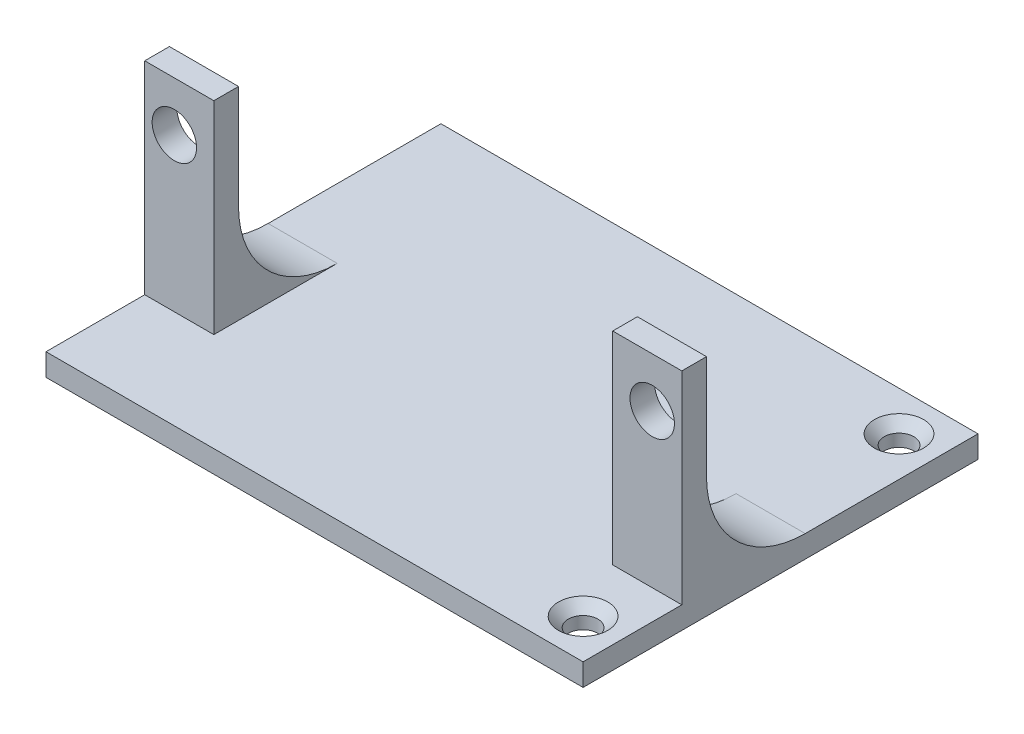
from build123d import *

# Parameters (mm, degrees)
CROQUIS1_W              = 7
CROQUIS1_H              = 7
SALIENTE_EXTRUIR1_DEPTH = 3
CROQUIS2_R              = 2.25
SALIENTE_EXTRUIR2_DEPTH = 2.5
CROQUIS3_W              = 7
CROQUIS3_H              = 9.5
SALIENTE_EXTRUIR3_DEPTH = 2
CROQUIS4_W              = 7
CROQUIS4_H              = 5
SALIENTE_EXTRUIR4_DEPTH = 20.02
CROQUIS5_W              = 29.52
CROQUIS5_H              = 5
SALIENTE_EXTRUIR5_DEPTH = 40.4
SALIENTE_EXTRUIR6_DEPTH = 7
CROQUIS7_R              = 2.25
CORTAR_EXTRUIR1_DEPTH   = 4.5
CROQUIS8_W              = 54.4
CROQUIS8_H              = 5
SALIENTE_EXTRUIR7_DEPTH = 0.48
CORTAR_EXTRUIR3_DEPTH   = 0.5
CROQUIS11_W             = 54.4
CROQUIS11_H             = 4.5
SALIENTE_EXTRUIR9_DEPTH = 10
CROQUIS12_R             = 1.5
CORTAR_EXTRUIR4_DEPTH   = 62.585797064
CHAFL_N1_SIZE           = 1
CROQUIS13_W             = 54.4
CROQUIS13_H             = 2.25
CORTAR_EXTRUIR5_DEPTH   = 69.707571635
REDONDEO1_R             = 10


with BuildPart() as part:
    # Croquis1 → Saliente-Extruir1 (new body)
    with BuildSketch(Plane(origin=(0, 0, 0), x_dir=(1, 0, 0), z_dir=(0, 1, 0))):
        Rectangle(CROQUIS1_W, CROQUIS1_H)
    extrude(amount=SALIENTE_EXTRUIR1_DEPTH)

    # Croquis2 → Saliente-Extruir2 (add)
    with BuildSketch(Plane.XY.offset(3.5)):
        Polygon((3.5, 3), (3.5, 23.02), (-3.5, 23.02), (-3.5, 3), (-3.5, 0), (3.5, 0), align=None)
        with Locations((0.5, 18.01)):
            Circle(CROQUIS2_R, mode=Mode.SUBTRACT)
    extrude(amount=SALIENTE_EXTRUIR2_DEPTH)

    # Croquis3 → Saliente-Extruir3 (add)
    with BuildSketch(Plane.XZ):
        with Locations((0, 1.25)):
            Rectangle(CROQUIS3_W, CROQUIS3_H)
    extrude(amount=SALIENTE_EXTRUIR3_DEPTH)

    # Croquis4 → Saliente-Extruir4 (add)
    with BuildSketch(Plane(origin=(0, 0, -3.5), x_dir=(-1, 0, 0), z_dir=(0, 0, -1))):
        with Locations((0, 0.5)):
            Rectangle(CROQUIS4_W, CROQUIS4_H)
    extrude(amount=SALIENTE_EXTRUIR4_DEPTH)

    # Croquis5 → Saliente-Extruir5 (add)
    with BuildSketch(Plane.ZY.offset(3.5)):
        with Locations((-8.76, 0.5)):
            Rectangle(CROQUIS5_W, CROQUIS5_H)
    extrude(amount=SALIENTE_EXTRUIR5_DEPTH)

    # Croquis6 → Saliente-Extruir6 (add)
    with BuildSketch(Plane.ZY.offset(43.9)):
        Polygon((6, 3), (6, 23.02), (3.5, 23.02), (3.5, 3), (-23.52, 3), (-23.52, -2), (6, -2), align=None)
    extrude(amount=SALIENTE_EXTRUIR6_DEPTH)

    # Croquis7 → Cortar-Extruir1 (cut)
    with BuildSketch(Plane.XY.offset(6)):
        with Locations((-47.9, 18.01)):
            Circle(CROQUIS7_R)
    extrude(amount=-CORTAR_EXTRUIR1_DEPTH, mode=Mode.SUBTRACT)

    # Croquis8 → Saliente-Extruir7 (add)
    with BuildSketch(Plane(origin=(0, 0, -23.52), x_dir=(-1, 0, 0), z_dir=(0, 0, -1))):
        with Locations((23.7, 0.5)):
            Rectangle(CROQUIS8_W, CROQUIS8_H)
    extrude(amount=SALIENTE_EXTRUIR7_DEPTH)

    # Croquis10 → Cortar-Extruir3 (cut)
    with BuildSketch(Plane(origin=(0, 3, 0), x_dir=(1, 0, 0), z_dir=(0, 1, 0))):
        Polygon((3.5, -3.5), (3.5, 24), (-50.9, 24), (-50.9, -3.5), (-43.9, -3.5), (-43.9, -6), (-3.5, -6), (-3.5, -3.5), align=None)
    extrude(amount=-CORTAR_EXTRUIR3_DEPTH, mode=Mode.SUBTRACT)

    # Croquis11 → Saliente-Extruir9 (add)
    with BuildSketch(Plane.XY.offset(6)):
        with Locations((-23.7, 0.25)):
            Rectangle(CROQUIS11_W, CROQUIS11_H)
    extrude(amount=SALIENTE_EXTRUIR9_DEPTH)

    # Croquis12 → Cortar-Extruir4 (cut, through all)
    with BuildSketch(Plane.XZ.offset(2)):
        with Locations(Location((-0.5, 12, 0), (0, 0, 270))):
            Circle(CROQUIS12_R)
        with Locations(Location((-0.5, -20, 0), (0, 0, 270))):
            Circle(CROQUIS12_R)
    extrude(amount=-CORTAR_EXTRUIR4_DEPTH, mode=Mode.SUBTRACT)

    # Chaflán1
    chafl_n1_edges = [part.edges().sort_by_distance(p)[0] for p in [
        (-0.5, 2.5, 13.5),
        (-0.5, 2.5, -18.5),
    ]]
    chamfer(chafl_n1_edges, length=CHAFL_N1_SIZE)

    # Croquis13 → Cortar-Extruir5 (cut, through all)
    with BuildSketch(Plane.XY.offset(16)):
        with Locations((-23.7, -0.875)):
            Rectangle(CROQUIS13_W, CROQUIS13_H)
    extrude(amount=-CORTAR_EXTRUIR5_DEPTH, mode=Mode.SUBTRACT)

    # Redondeo1
    redondeo1_edges = [part.edges().sort_by_distance(p)[0] for p in [
        (0, 2.5, 3.5),
        (-47.4, 2.5, 3.5),
    ]]
    fillet(redondeo1_edges, radius=REDONDEO1_R)


solid = part.part
